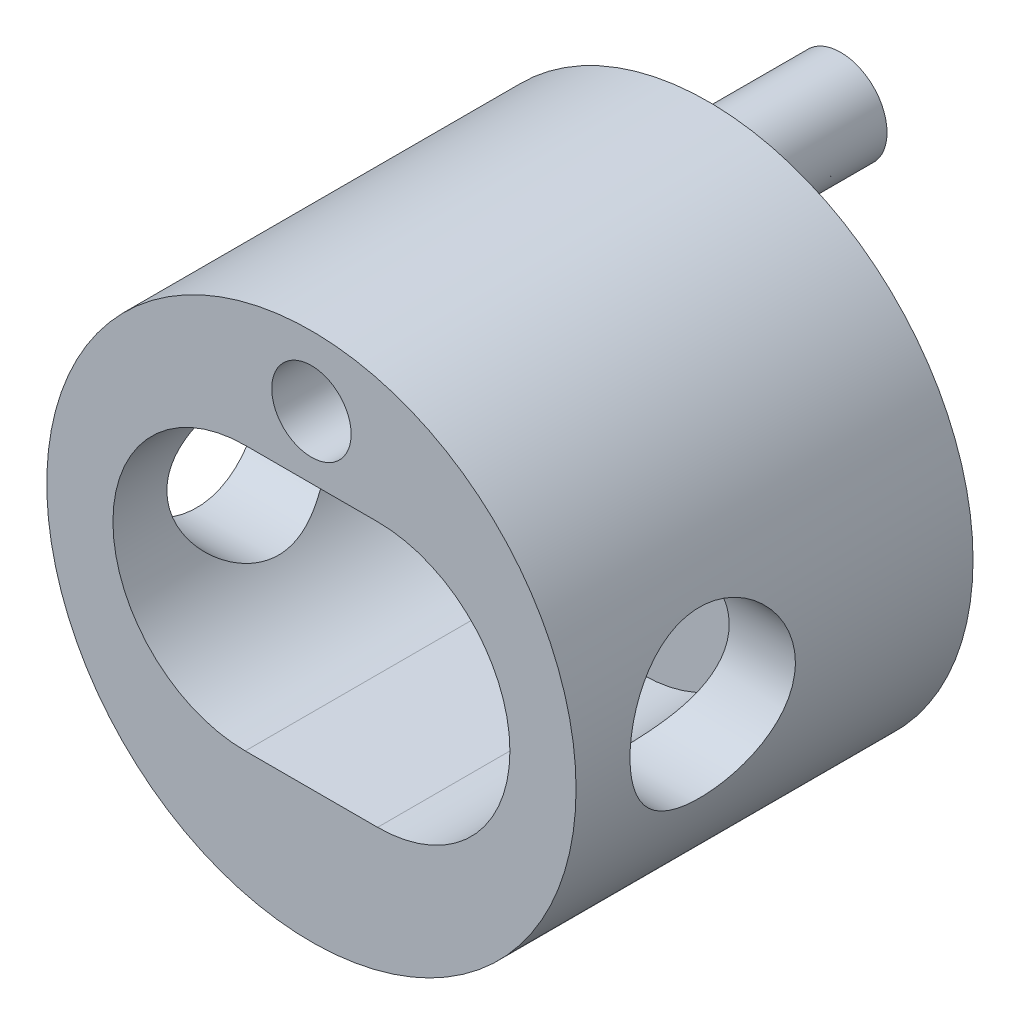
from build123d import *

# Parameters (mm, degrees)
SKETCH1_R               = 20
BOSS_EXTRUDE1_DEPTH     = 30
CUT_EXTRUDE1_DEPTH      = 20
SKETCH3_R               = 3
CUT_EXTRUDE2_DEPTH      = 35
CUT_EXTRUDE3_DEPTH      = 28
CUT_EXTRUDE3_DEPTH_BACK = 31
SKETCH4_R               = 6.25
SKETCH5_R               = 2.3
CUT_EXTRUDE4_DEPTH      = 30
SKETCH9_R               = 3.5
BOSS_EXTRUDE4_DEPTH     = 10
CUT_EXTRUDE6_START      = -10
SKETCH11_R              = 3
CUT_EXTRUDE6_DEPTH      = 10


with BuildPart() as part:
    # Sketch1 → Boss-Extrude1 (new body)
    with BuildSketch(Plane.XY):
        Circle(SKETCH1_R)
    extrude(amount=BOSS_EXTRUDE1_DEPTH)

    # Sketch2 → Cut-Extrude1 (cut)
    with BuildSketch(Plane.XY.offset(30)):
        with BuildLine():
            Line((-5, 10), (5, 10))
            ThreePointArc((5, 10), (15, 0), (5, -10))
            Line((5, -10), (-5, -10))
            ThreePointArc((-5, -10), (-15, 0), (-5, 10))
        make_face()
    extrude(amount=-CUT_EXTRUDE1_DEPTH, mode=Mode.SUBTRACT)

    # Sketch3 → Cut-Extrude2 (cut)
    with BuildSketch(Plane.XY.offset(30)):
        with Locations((0, 14.722991755)):
            Circle(SKETCH3_R)
    extrude(amount=-CUT_EXTRUDE2_DEPTH, mode=Mode.SUBTRACT)

    # Sketch4 → Cut-Extrude3 (cut, two sides: drawn at the far end of the back side and taken through both)
    with BuildSketch(Plane(origin=(0, 0, 0), x_dir=(0, 0, -1), z_dir=(1, 0, 0)).offset(-CUT_EXTRUDE3_DEPTH_BACK)):
        with Locations(Location((-19.676237733, 0, 0), (0, 0, 180))):
            Circle(SKETCH4_R)
    extrude(amount=CUT_EXTRUDE3_DEPTH + CUT_EXTRUDE3_DEPTH_BACK, mode=Mode.SUBTRACT)

    # Sketch5 → Cut-Extrude4 (cut)
    with BuildSketch(Plane(origin=(0, 0, 0), x_dir=(-1, 0, 0), z_dir=(0, 0, -1))):
        Circle(SKETCH5_R)
    extrude(amount=-CUT_EXTRUDE4_DEPTH, mode=Mode.SUBTRACT)

    # Sketch9 → Boss-Extrude4 (add)
    with BuildSketch(Plane(origin=(0, 0, 0), x_dir=(-1, 0, 0), z_dir=(0, 0, -1))):
        with Locations(Location((0, 14.722991755, 0), (0, 0, 180))):
            Circle(SKETCH9_R)
    extrude(amount=BOSS_EXTRUDE4_DEPTH)

    # Sketch11 → Cut-Extrude6 (cut)
    with BuildSketch(Plane(origin=(0, 0, -10), x_dir=(-1, 0, 0), z_dir=(0, 0, -1)).offset(CUT_EXTRUDE6_START)):
        with Locations(Location((0, 14.722991755, 0), (0, 0, 180))):
            Circle(SKETCH11_R)
    extrude(amount=CUT_EXTRUDE6_DEPTH, mode=Mode.SUBTRACT)


solid = part.part
